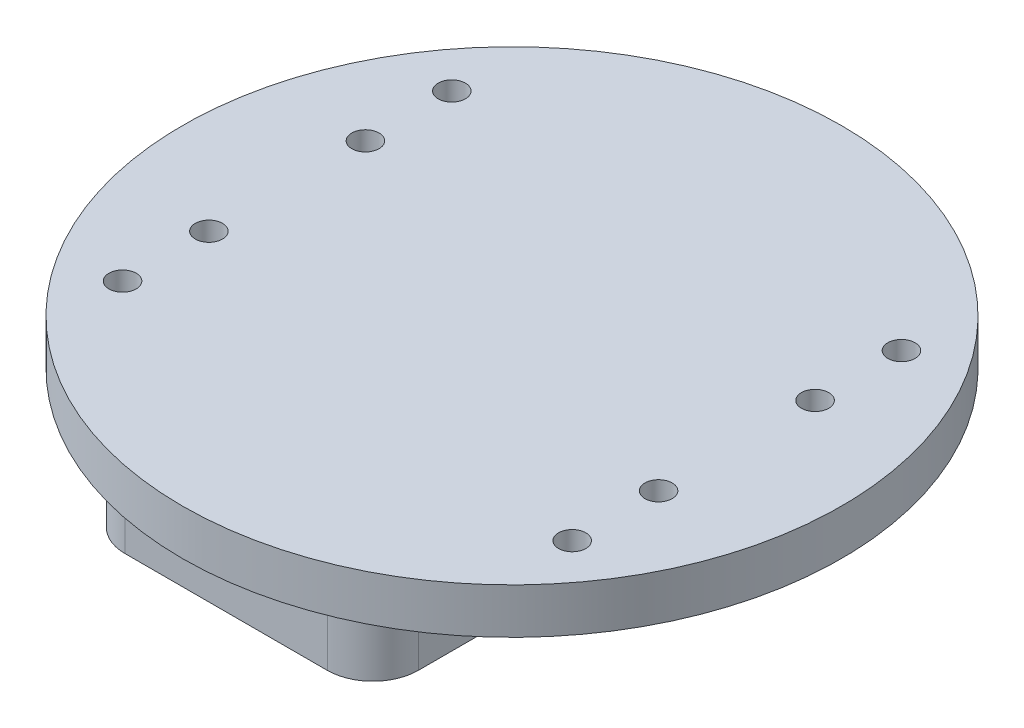
from build123d import *

# Parameters (mm, degrees)
SKETCH1_R               = 72.5
BOSS_EXTRUDE1_DEPTH     = 10
BOSS_EXTRUDE2_DEPTH     = 15
SKETCH3_R               = 3
CUT_EXTRUDE1_DEPTH      = 10
MIRROR3_COPY_1_SKETCH_R = 3
MIRROR3_COPY_1_DEPTH    = 10


with BuildPart() as part:
    # Sketch1 → Boss-Extrude1 (new body)
    with BuildSketch(Plane(origin=(0, 0, 0), x_dir=(1, 0, 0), z_dir=(0, 1, 0))):
        with Locations(Location((0, 0, 0), (0, 0, 270))):
            Circle(SKETCH1_R)
    extrude(amount=BOSS_EXTRUDE1_DEPTH)

    # Sketch2 → Boss-Extrude2 (add)
    with BuildSketch(Plane.XZ):
        with BuildLine():
            Line((-22.246900451, 62.865113828), (22.246900451, 62.865113828))
            ThreePointArc((22.246900451, 62.865113828), (29.317968263, 59.93618164), (32.246900451, 52.865113828))
            Line((32.246900451, 52.865113828), (32.246900451, 15.536222894))
            Line((32.246900451, 15.536222894), (-32.246900451, 15.536222894))
            Line((-32.246900451, 15.536222894), (-32.246900451, 52.865113828))
            ThreePointArc((-32.246900451, 52.865113828), (-29.317968263, 59.93618164), (-22.246900451, 62.865113828))
        make_face()
    boss_extrude2 = extrude(amount=BOSS_EXTRUDE2_DEPTH)

    # Mirror1: Boss-Extrude2 across plane
    add(boss_extrude2.mirror(Plane.XY))

    # Sketch3 → Cut-Extrude1 (cut)
    with BuildSketch(Plane.XZ):
        with Locations(Location((-49.458347743, 36.215950375, 0), (0, 0, 270))):
            Circle(SKETCH3_R)
        with Locations(Location((-49.458347743, 17.215950375, 0), (0, 0, 270))):
            Circle(SKETCH3_R)
    cut_extrude1 = extrude(amount=-CUT_EXTRUDE1_DEPTH, mode=Mode.SUBTRACT)

    # Mirror2: Cut-Extrude1 across plane
    add(cut_extrude1.mirror(Plane.XY), mode=Mode.SUBTRACT)

    # Mirror3: Cut-Extrude1 across plane
    add(cut_extrude1.mirror(Plane(origin=(0, 0, 0), x_dir=(0, 0, 1), z_dir=(1, 0, 0))), mode=Mode.SUBTRACT)

    # Mirror3 copy 1 sketch → Mirror3 copy 1 (cut)
    with BuildSketch(Plane(origin=(0, 0, 0), x_dir=(-1, 0, 0), z_dir=(0, -1, 0))):
        with Locations(Location((-49.458347743, 36.215950375, 0), (0, 0, 270))):
            Circle(MIRROR3_COPY_1_SKETCH_R)
        with Locations(Location((-49.458347743, 17.215950375, 0), (0, 0, 270))):
            Circle(MIRROR3_COPY_1_SKETCH_R)
    extrude(amount=-MIRROR3_COPY_1_DEPTH, mode=Mode.SUBTRACT)


solid = part.part
